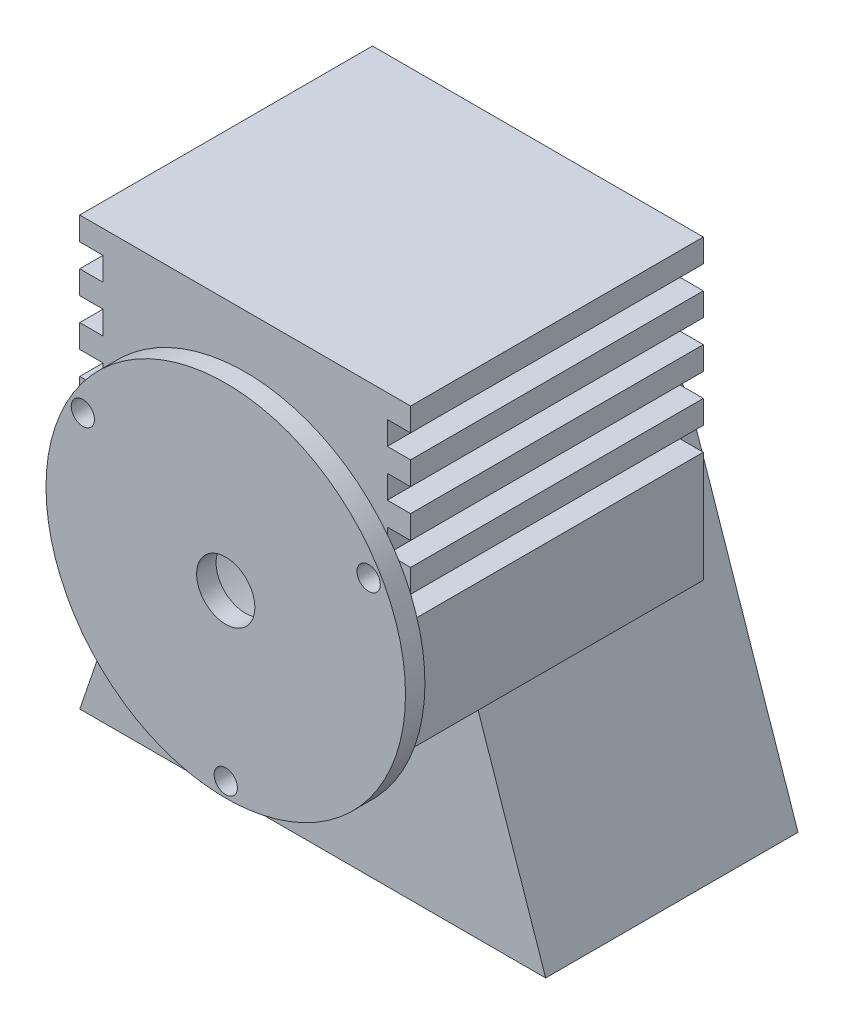
from build123d import *

# Parameters (mm, degrees)
BOSS_EXTRUDE1_DEPTH      = 162.5
BOSS_EXTRUDE2_DEPTH      = 43.5
BOSS_EXTRUDE2_DEPTH_BACK = 145
SKETCH3_R                = 81.25
CUT_EXTRUDE1_DEPTH       = 150
SKETCH6_R                = 87.5
SKETCH6_R_2              = 81.25
BOSS_EXTRUDE4_DEPTH      = 43.5
SKETCH7_R                = 115.75
BOSS_EXTRUDE5_DEPTH      = 12.5
SKETCH8_R                = 7.5
CUT_EXTRUDE2_DEPTH       = 12.5
CUT_EXTRUDE3_DEPTH       = 315.329842681
CUT_EXTRUDE3_DEPTH_BACK  = 315.329842681
SKETCH9_R                = 18.75


with BuildPart() as part:
    # Sketch1 → Boss-Extrude1 (new body)
    with BuildSketch(Plane.XY):
        with BuildLine():
            Line((-150, -169), (150, -169))
            Line((150, -169), (82.827141263, 28.211959701))
            ThreePointArc((82.827141263, 28.211959701), (0, 87.5), (-82.827141263, 28.211959701))
            Line((-82.827141263, 28.211959701), (-150, -169))
        make_face()
    extrude(amount=BOSS_EXTRUDE1_DEPTH)

    # Sketch2 → Boss-Extrude2 (add, two sides: drawn at the far end of the back side and taken through both)
    with BuildSketch(Plane.XY.offset(162.5).offset(-BOSS_EXTRUDE2_DEPTH_BACK)):
        with BuildLine():
            Line((-106.53243077, 150), (106.53243077, 150))
            Line((106.53243077, 150), (106.53243077, 135))
            Line((106.53243077, 135), (91.53243077, 135))
            Line((91.53243077, 135), (91.53243077, 120))
            Line((91.53243077, 120), (106.53243077, 120))
            Line((106.53243077, 120), (106.53243077, 105))
            Line((106.53243077, 105), (91.53243077, 105))
            Line((91.53243077, 105), (91.53243077, 90))
            Line((91.53243077, 90), (106.53243077, 90))
            Line((106.53243077, 90), (106.53243077, 75))
            Line((106.53243077, 75), (91.53243077, 75))
            Line((91.53243077, 75), (91.53243077, 60))
            Line((91.53243077, 60), (106.53243077, 60))
            Line((106.53243077, 60), (106.53243077, 45))
            Line((106.53243077, 45), (91.53243077, 45))
            Line((91.53243077, 45), (91.53243077, 30))
            Line((91.53243077, 30), (106.53243077, 30))
            Line((106.53243077, 30), (106.53243077, -41.384104643))
            Line((106.53243077, -41.384104643), (82.827141263, 28.211959701))
            ThreePointArc((82.827141263, 28.211959701), (0, 87.5), (-82.827141263, 28.211959701))
            Line((-82.827141263, 28.211959701), (-106.53243077, -41.384104643))
            Line((-106.53243077, -41.384104643), (-106.53243077, 30))
            Line((-106.53243077, 30), (-91.53243077, 30))
            Line((-91.53243077, 30), (-91.53243077, 45))
            Line((-91.53243077, 45), (-106.53243077, 45))
            Line((-106.53243077, 45), (-106.53243077, 60))
            Line((-106.53243077, 60), (-91.53243077, 60))
            Line((-91.53243077, 60), (-91.53243077, 75))
            Line((-91.53243077, 75), (-106.53243077, 75))
            Line((-106.53243077, 75), (-106.53243077, 90))
            Line((-106.53243077, 90), (-91.53243077, 90))
            Line((-91.53243077, 90), (-91.53243077, 105))
            Line((-91.53243077, 105), (-106.53243077, 105))
            Line((-106.53243077, 105), (-106.53243077, 120))
            Line((-106.53243077, 120), (-91.53243077, 120))
            Line((-91.53243077, 120), (-91.53243077, 135))
            Line((-91.53243077, 135), (-106.53243077, 135))
            Line((-106.53243077, 135), (-106.53243077, 150))
        make_face()
    extrude(amount=BOSS_EXTRUDE2_DEPTH + BOSS_EXTRUDE2_DEPTH_BACK)

    # Sketch3 → Cut-Extrude1 (cut)
    with BuildSketch(Plane.XY.offset(162.5)):
        Circle(SKETCH3_R)
    extrude(amount=-CUT_EXTRUDE1_DEPTH, mode=Mode.SUBTRACT)

    # Sketch6 → Boss-Extrude4 (add, through all)
    with BuildSketch(Plane.XY.offset(162.5)):
        Circle(SKETCH6_R)
        Circle(SKETCH6_R_2, mode=Mode.SUBTRACT)
    extrude(amount=BOSS_EXTRUDE4_DEPTH)

    # Sketch7 → Boss-Extrude5 (add)
    with BuildSketch(Plane.XY.offset(206)):
        with Locations(Location((0, 0, 0), (0, 0, 156.979731296))):
            Circle(SKETCH7_R)
    extrude(amount=BOSS_EXTRUDE5_DEPTH)

    # Sketch8 → Cut-Extrude2 (cut)
    with BuildSketch(Plane.XY.offset(218.5)):
        with Locations((0, -106.25)):
            Circle(SKETCH8_R)
        with Locations((-92.015199152, 53.125)):
            Circle(SKETCH8_R)
        with Locations((92.015199152, 53.125)):
            Circle(SKETCH8_R)
    extrude(amount=-CUT_EXTRUDE2_DEPTH, mode=Mode.SUBTRACT)

    # Sketch9 → Cut-Extrude3 (cut, two sides: drawn at the far end of the back side and taken through both)
    with BuildSketch(Plane.XY.offset(218.5).offset(-CUT_EXTRUDE3_DEPTH_BACK)):
        Circle(SKETCH9_R)
    extrude(amount=CUT_EXTRUDE3_DEPTH + CUT_EXTRUDE3_DEPTH_BACK, mode=Mode.SUBTRACT)


solid = part.part
